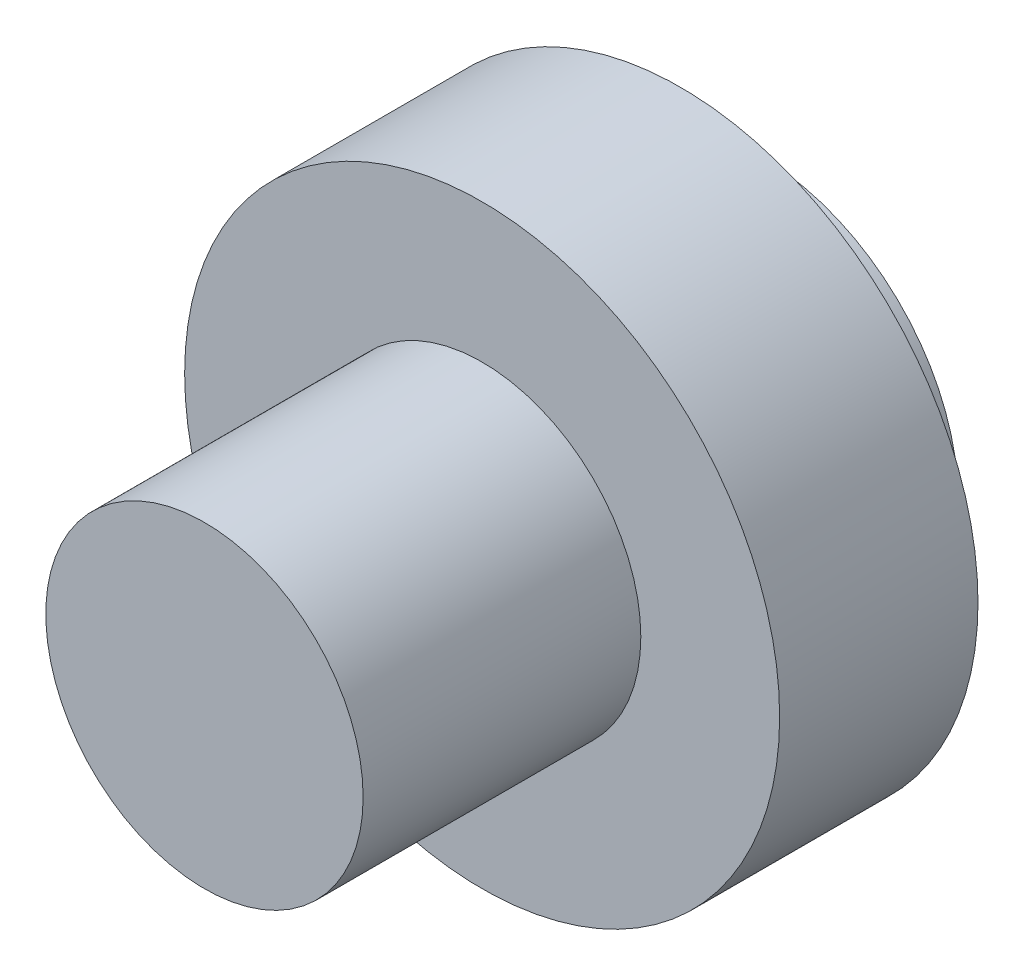
from build123d import *

# Parameters (mm, degrees)
SCHIZZO1_R                   = 5
ESTRUSIONE_ESTRUSIONE1_DEPTH = 2
SCHIZZO2_R                   = 7.5
ESTRUSIONE_ESTRUSIONE2_DEPTH = 5
SCHIZZO3_R                   = 4
ESTRUSIONE_ESTRUSIONE3_DEPTH = 7


with BuildPart() as part:
    # Schizzo1 → Estrusione-Estrusione1 (new body)
    with BuildSketch(Plane.XY):
        Circle(SCHIZZO1_R)
    extrude(amount=ESTRUSIONE_ESTRUSIONE1_DEPTH)

    # Schizzo2 → Estrusione-Estrusione2 (add)
    with BuildSketch(Plane.XY.offset(2)):
        Circle(SCHIZZO2_R)
    extrude(amount=ESTRUSIONE_ESTRUSIONE2_DEPTH)

    # Schizzo3 → Estrusione-Estrusione3 (add)
    with BuildSketch(Plane.XY.offset(7)):
        Circle(SCHIZZO3_R)
    extrude(amount=ESTRUSIONE_ESTRUSIONE3_DEPTH)


solid = part.part
